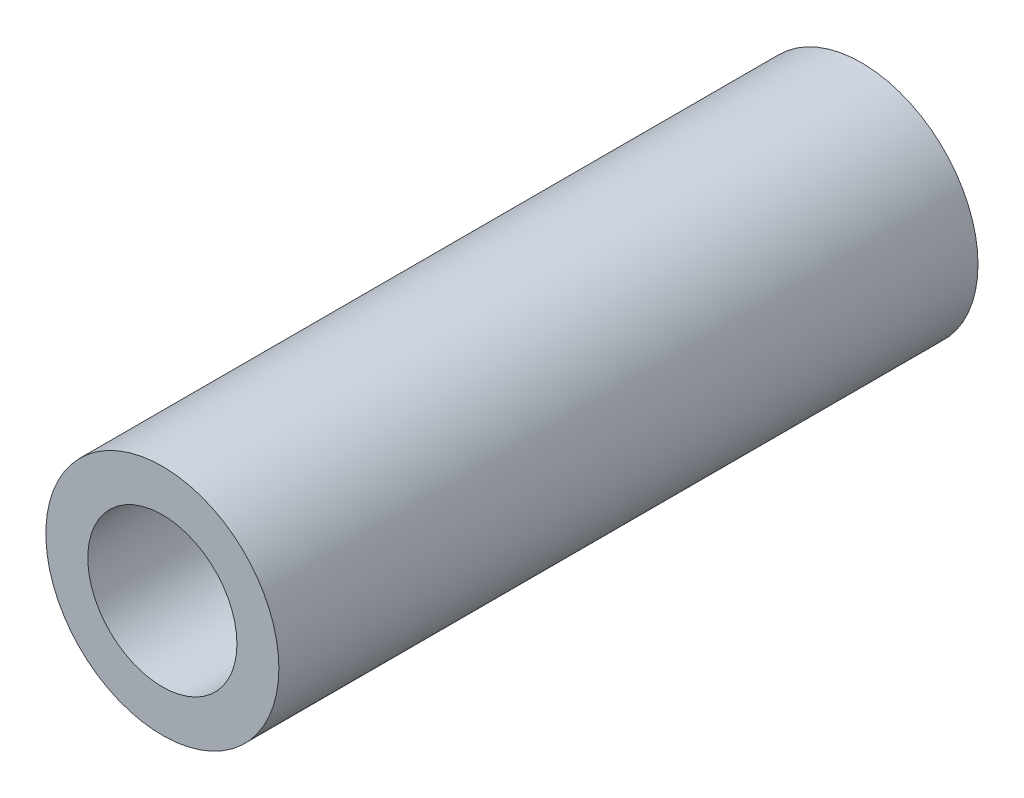
from build123d import *

# Parameters (mm, degrees)
SKETCH_1_R      = 2.5
SKETCH_1_R_2    = 1.6
EXTRUDE_1_DEPTH = 15


with BuildPart() as part:
    # ｽｹｯﾁ1 → ﾎﾞｽ - 押し出し1 (new body)
    with BuildSketch(Plane.XY):
        Circle(SKETCH_1_R)
        Circle(SKETCH_1_R_2, mode=Mode.SUBTRACT)
    extrude(amount=EXTRUDE_1_DEPTH)


solid = part.part
